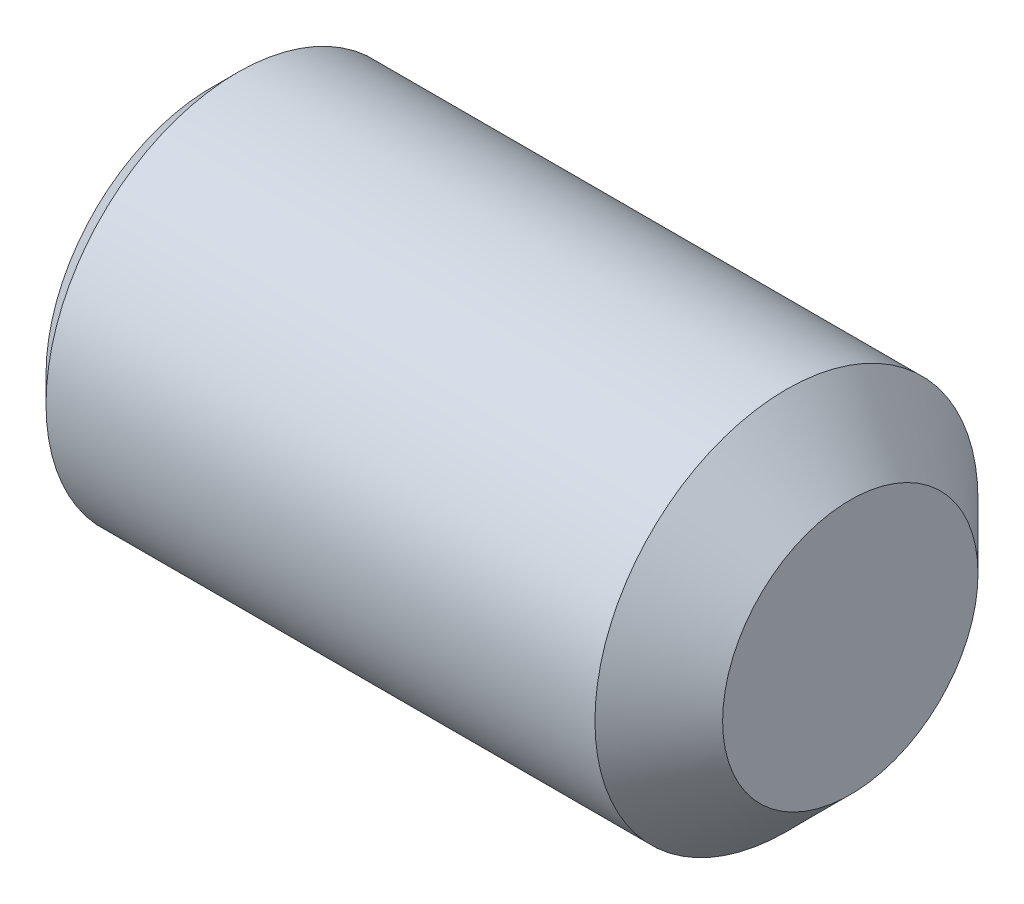
from build123d import *

# Parameters (mm, degrees)
CUT_EXTRUDE_1_DEPTH = 2


with BuildPart() as part:
    # 草图1 → Revolve 607 (revolve)
    with BuildSketch(Plane.XY, mode=Mode.PRIVATE) as revolve_607_sk:
        Polygon((0, 0), (10, 0), (10, 2), (9, 3), (0.402, 3), (0, 2.598), align=None)
    revolve(revolve_607_sk.sketch.rotate(Axis((-0.277777778, 0, 0), (1, 0, 0)), 90), axis=Axis((-0.277777778, 0, 0), (1, 0, 0)))

    # 草图2 → 切除-拉伸1 (cut)
    with BuildSketch(Plane.ZY):
        Polygon((-0.86, -1.489563695), (0.86, -1.489563695), (1.72, 0), (0.86, 1.489563695), (-0.86, 1.489563695), (-1.72, 0), align=None)
    extrude(amount=-CUT_EXTRUDE_1_DEPTH, mode=Mode.SUBTRACT)

    # 草图4 → 切除-旋转2 (revolve, cut)
    with BuildSketch(Plane.XY, mode=Mode.PRIVATE) as cut_revolve_2_sk:
        Polygon((2, 1.489563695), (2.86, 0), (2, 0), align=None)
    revolve(cut_revolve_2_sk.sketch.rotate(Axis((-0.277777778, 0, 0), (1, 0, 0)), 90), axis=Axis((-0.277777778, 0, 0), (1, 0, 0)), mode=Mode.SUBTRACT)


solid = part.part
